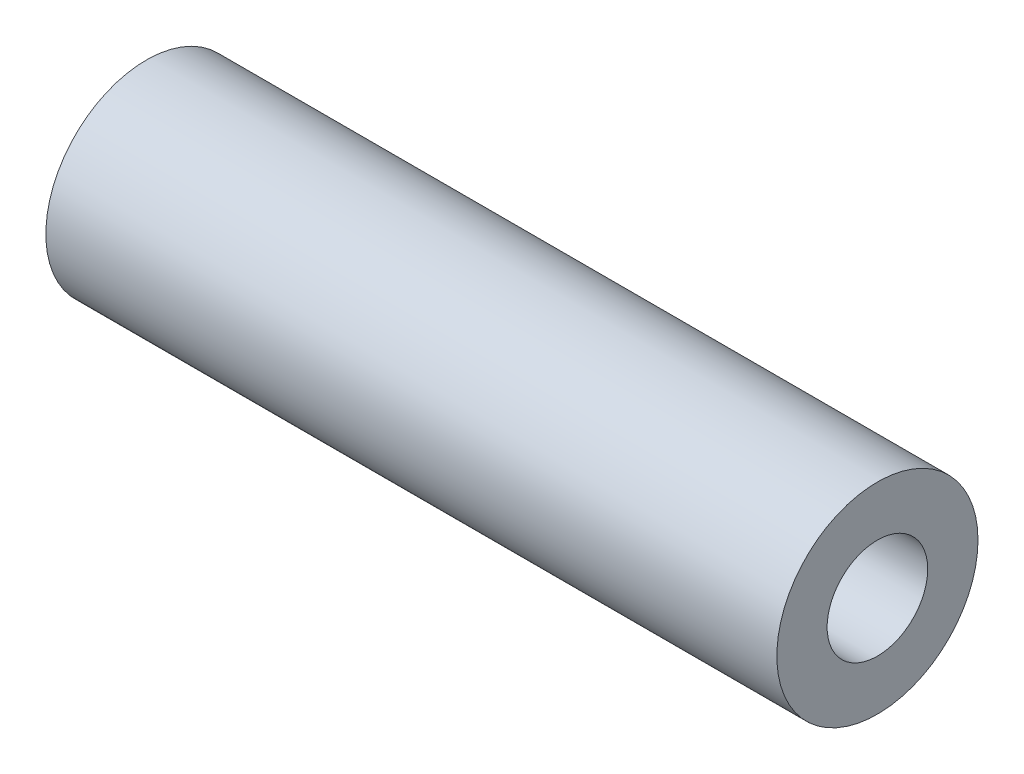
from build123d import *

# Parameters (mm, degrees)
SKETCH1_R           = 6.35
SKETCH1_R_2         = 3.175
BOSS_EXTRUDE1_DEPTH = 23.0759


with BuildPart() as part:
    # Sketch1 → Boss-Extrude1 (new, symmetric)
    with BuildSketch(Plane(origin=(0, 0, 0), x_dir=(0, 0, -1), z_dir=(1, 0, 0))):
        Circle(SKETCH1_R)
        Circle(SKETCH1_R_2, mode=Mode.SUBTRACT)
    extrude(amount=BOSS_EXTRUDE1_DEPTH, both=True)


solid = part.part
